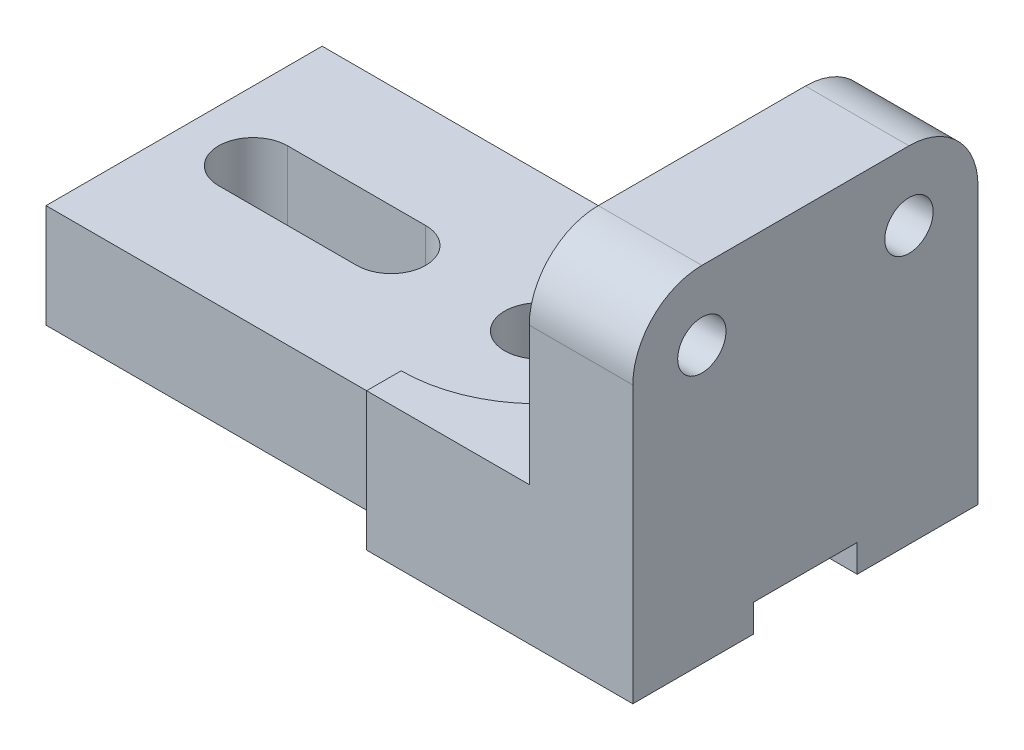
from build123d import *

# Parameters (mm, degrees)
Y_KSEKLIK_EKSTR_ZYON2_DEPTH = 50
Y_KSEKLIK_EKSTR_ZYON3_DEPTH = 5
IZIM3_W                     = 51.443502464
IZIM3_H                     = 5
KES_EKSTR_ZYON1_DEPTH       = 15
IZIM4_W                     = 15
IZIM4_H                     = 4
KES_EKSTR_ZYON2_DEPTH       = 90
RADYUS2_R                   = 10
RADYUS3_R                   = 10
KES_EKSTR_ZYON3_REACH       = 96.271
IZIM5_R                     = 3.5
KES_EKSTR_ZYON4_DEPTH       = 103.312244464
KES_EKSTR_ZYON4_DEPTH_BACK  = 103.312244464
IZIM6_R                     = 5


with BuildPart() as part:
    # Çizim1 → Yükseklik-Ekstrüzyon2 (new body)
    with BuildSketch(Plane.XY):
        Polygon((-7.114525921, 27.60391198), (7.885474079, 27.60391198), (7.885474079, -22.39608802), (-82.114525921, -22.39608802), (-82.114525921, -7.39608802), (-7.114525921, -7.39608802), align=None)
    extrude(amount=Y_KSEKLIK_EKSTR_ZYON2_DEPTH)

    # Çizim2 → Yükseklik-Ekstrüzyon3 (add)
    with BuildSketch(Plane(origin=(0, -7.39608802, 0), x_dir=(1, 0, 0), z_dir=(0, 1, 0))):
        with BuildLine():
            Line((-7.114525921, 0), (-30.671023457, 0))
            Line((-30.671023457, 0), (-30.671023457, -5))
            ThreePointArc((-30.671023457, -5), (-10.671023457, -25), (-30.671023457, -45))
            Line((-30.671023457, -45), (-30.671023457, -50))
            Line((-30.671023457, -50), (-7.114525921, -50))
            Line((-7.114525921, -50), (-7.114525921, 0))
        make_face()
    extrude(amount=Y_KSEKLIK_EKSTR_ZYON3_DEPTH)

    # Çizim3 → Kes-Ekstrüzyon1 (cut)
    with BuildSketch(Plane(origin=(0, -7.39608802, 0), x_dir=(1, 0, 0), z_dir=(0, 1, 0))):
        with Locations((-56.392774689, -2.5)):
            Rectangle(IZIM3_W, IZIM3_H)
        with Locations((-56.392774689, -47.5)):
            Rectangle(IZIM3_W, IZIM3_H)
    extrude(amount=-KES_EKSTR_ZYON1_DEPTH, mode=Mode.SUBTRACT)

    # Çizim4 → Kes-Ekstrüzyon2 (cut)
    with BuildSketch(Plane.ZY.offset(82.114525921)):
        with Locations((25, -20.39608802)):
            Rectangle(IZIM4_W, IZIM4_H)
    extrude(amount=-KES_EKSTR_ZYON2_DEPTH, mode=Mode.SUBTRACT)

    # Radyus2
    radyus2_edges = [part.edges().sort_by_distance(p)[0] for p in [
        (0.385474079, 27.60391198, 0),
    ]]
    fillet(radyus2_edges, radius=RADYUS2_R)

    # Radyus3
    radyus3_edges = [part.edges().sort_by_distance(p)[0] for p in [
        (0.385474079, 27.60391198, 50),
    ]]
    fillet(radyus3_edges, radius=RADYUS3_R)

    # Çizim5 → Kes-Ekstrüzyon3 (cut, up to next)
    with BuildSketch(Plane.ZY.offset(7.114525921), mode=Mode.PRIVATE) as kes_ekstr_zyon3_sk1:
        with Locations(Location((10, 17.60391198, 0), (0, 0, 270))):
            Circle(IZIM5_R)
    kes_ekstr_zyon3_tool1 = extrude(kes_ekstr_zyon3_sk1.sketch, amount=-KES_EKSTR_ZYON3_REACH, mode=Mode.PRIVATE) & part.part
    # Çizim5 → Kes-Ekstrüzyon3 (cut, up to next)
    with BuildSketch(Plane.ZY.offset(7.114525921), mode=Mode.PRIVATE) as kes_ekstr_zyon3_sk2:
        with Locations(Location((40, 17.60391198, 0), (0, 0, 270))):
            Circle(IZIM5_R)
    kes_ekstr_zyon3_tool2 = extrude(kes_ekstr_zyon3_sk2.sketch, amount=-KES_EKSTR_ZYON3_REACH, mode=Mode.PRIVATE) & part.part
    add(kes_ekstr_zyon3_tool1.solids().sort_by_distance((-7.114526, 17.603912, 10))[0], mode=Mode.SUBTRACT)
    add(kes_ekstr_zyon3_tool2.solids().sort_by_distance((-7.114526, 17.603912, 40))[0], mode=Mode.SUBTRACT)

    # Çizim6 → Kes-Ekstrüzyon4 (cut, two sides: drawn at the far end of the back side and taken through both)
    with BuildSketch(Plane(origin=(0, -7.39608802, 0), x_dir=(1, 0, 0), z_dir=(0, 1, 0)).offset(-KES_EKSTR_ZYON4_DEPTH_BACK)):
        with Locations((-30.671023457, -25)):
            Circle(IZIM6_R)
        with BuildLine():
            Line((-72.114525921, -20), (-52.114525921, -20))
            ThreePointArc((-52.114525921, -20), (-47.114525921, -25), (-52.114525921, -30))
            Line((-52.114525921, -30), (-72.114525921, -30))
            ThreePointArc((-72.114525921, -30), (-77.114525921, -25), (-72.114525921, -20))
        make_face()
    extrude(amount=KES_EKSTR_ZYON4_DEPTH + KES_EKSTR_ZYON4_DEPTH_BACK, mode=Mode.SUBTRACT)


solid = part.part
